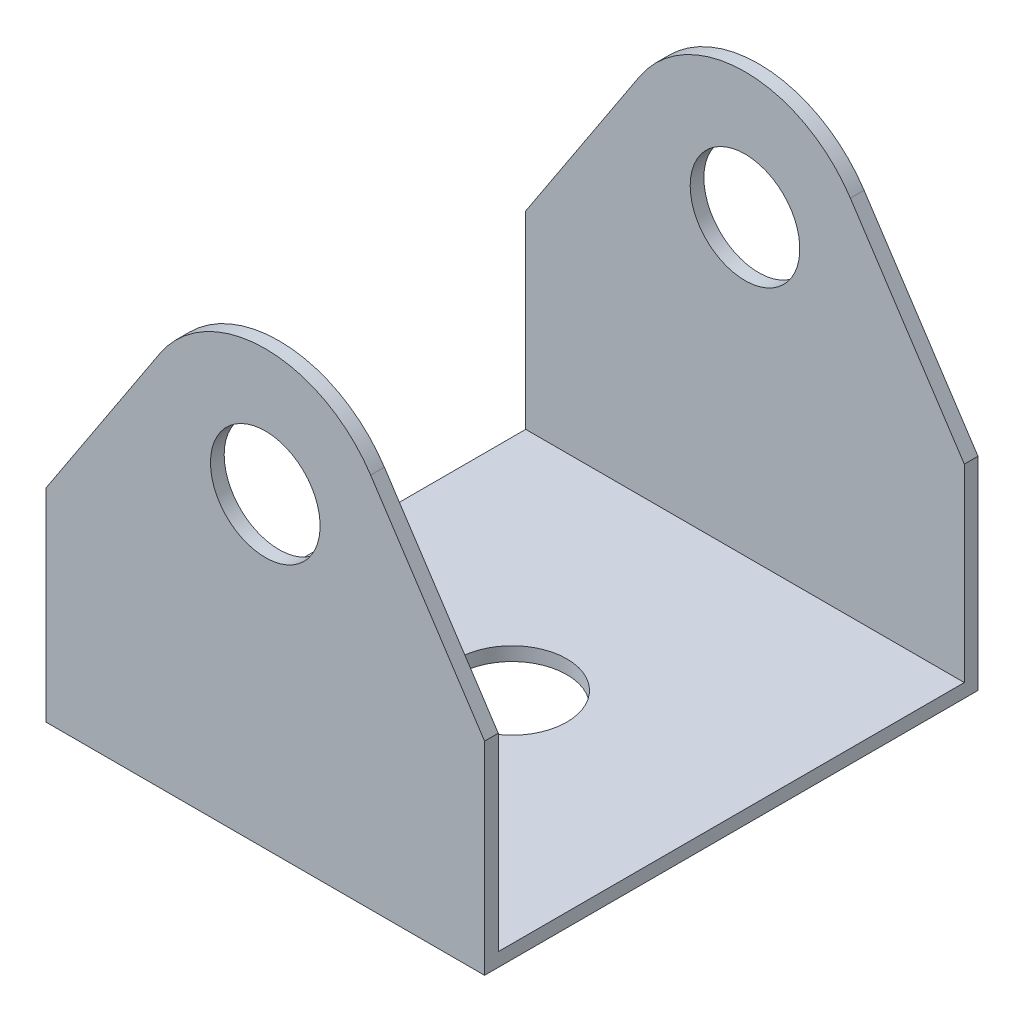
from build123d import *

# Parameters (mm, degrees)
EXTRUSION1_DEPTH        = 90
COQUE1_T                = -2.5
ESQUISSE2_R             = 10
ENL_V_MAT_EXTRU_1_DEPTH = 90
ESQUISSE3_R             = 10
ENL_V_MAT_EXTRU_2_DEPTH = 114.296072306


with BuildPart() as part:
    # Esquisse1 → Extrusion1 (new body)
    with BuildSketch(Plane.XY):
        with BuildLine():
            Line((40, -56), (-40, -56))
            Line((-40, -56), (-40, -19))
            Line((-40, -19), (-19.223282024, 12.627962156))
            ThreePointArc((-19.223282024, 12.627962156), (0, 23), (19.223282024, 12.627962156))
            Line((19.223282024, 12.627962156), (40, -19))
            Line((40, -19), (40, -56))
        make_face()
    extrude(amount=EXTRUSION1_DEPTH)

    # Coque1
    coque1_openings = [part.faces().sort_by_distance(p)[0] for p in [
        (40, -37.5, 45),
        (-40, -37.5, 45),
        (-29.611641012, -3.186018922, 45),
        (0, 23, 45),
        (29.611641012, -3.186018922, 45),
    ]]
    offset(amount=COQUE1_T, openings=coque1_openings, kind=Kind.INTERSECTION)

    # Esquisse2 → Enlèv. mat.-Extru.1 (cut)
    with BuildSketch(Plane.XZ.offset(56)):
        with Locations(Location((0, 45, 0), (0, 0, 270))):
            Circle(ESQUISSE2_R)
    extrude(amount=-ENL_V_MAT_EXTRU_1_DEPTH, mode=Mode.SUBTRACT)

    # Esquisse3 → Enlèv. mat.-Extru.2 (cut, through all)
    with BuildSketch(Plane(origin=(0, 0, 0), x_dir=(-1, 0, 0), z_dir=(0, 0, -1))):
        Circle(ESQUISSE3_R)
    extrude(amount=-ENL_V_MAT_EXTRU_2_DEPTH, mode=Mode.SUBTRACT)


solid = part.part
